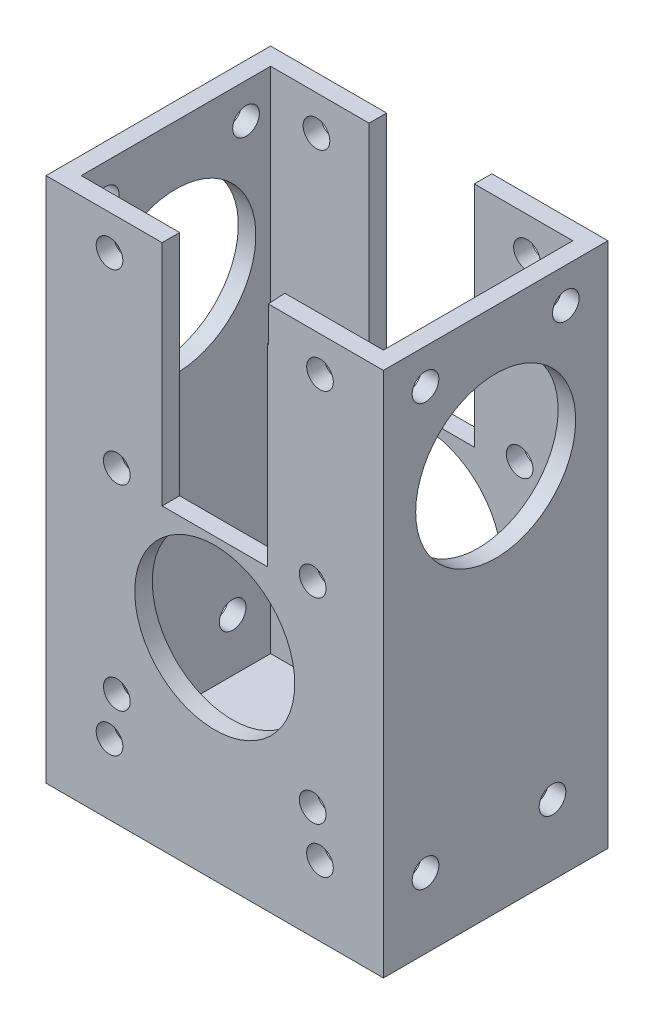
from build123d import *

# Parameters (mm, degrees)
SKETCH1_W           = 61.0616
SKETCH1_H           = 40.64
BOSS_EXTRUDE1_DEPTH = 82.55
SKETCH13_W          = 54.7116
SKETCH13_H          = 34.29
CUT_EXTRUDE1_DEPTH  = 82.55
SKETCH15_R          = 14.478
CUT_EXTRUDE2_DEPTH  = 3.175
CUT_EXTRUDE3_START  = -37.465
SKETCH16_R          = 14.478
CUT_EXTRUDE3_DEPTH  = 3.175
CUT_EXTRUDE4_START  = -61.0616
SKETCH18_R          = 14.478
CUT_EXTRUDE4_DEPTH  = 61.0616
CUT_EXTRUDE5_START  = -40.64
SKETCH19_W          = 19.05
SKETCH19_H          = 34.925
CUT_EXTRUDE5_DEPTH  = 40.64
CUT_EXTRUDE6_START  = -40.64
SKETCH20_R          = 2.413
CUT_EXTRUDE6_DEPTH  = 40.64
CUT_EXTRUDE7_START  = -40.64
SKETCH21_R          = 2.413
CUT_EXTRUDE7_DEPTH  = 40.64
CUT_EXTRUDE8_START  = -40.64
SKETCH24_R          = 2.413
CUT_EXTRUDE8_DEPTH  = 40.64
CUT_EXTRUDE9_START  = -40.64
SKETCH25_R          = 2.413
CUT_EXTRUDE9_DEPTH  = 40.64
BOSS_EXTRUDE2_DEPTH = 6.35
BOSS_EXTRUDE3_DEPTH = 6.35
SKETCH53_W          = 61.0616
SKETCH53_H          = 40.64
SKETCH53_W_2        = 54.7116
SKETCH53_H_2        = 34.29
BOSS_EXTRUDE5_DEPTH = 3.175
SKETCH54_W          = 61.0616
SKETCH54_H          = 40.64
BOSS_EXTRUDE6_DEPTH = 3.175
CUT_EXTRUDE14_START = -40.64
SKETCH45_R          = 2.413
CUT_EXTRUDE14_DEPTH = 40.64
CUT_EXTRUDE18_START = -40.64
SKETCH59_R          = 2.413
CUT_EXTRUDE18_DEPTH = 40.64
CUT_EXTRUDE19_START = -40.64
SKETCH60_R          = 2.413
CUT_EXTRUDE19_DEPTH = 40.64
CUT_EXTRUDE20_START = -40.64
SKETCH61_R          = 2.413
CUT_EXTRUDE20_DEPTH = 40.64
CUT_EXTRUDE21_START = -61.0616
SKETCH63_R          = 2.413
CUT_EXTRUDE21_DEPTH = 61.0616
CUT_EXTRUDE22_START = -61.0616
SKETCH64_R          = 2.413
CUT_EXTRUDE22_DEPTH = 61.0616
CUT_EXTRUDE23_START = -61.0616
SKETCH65_R          = 2.413
CUT_EXTRUDE23_DEPTH = 61.0616
CUT_EXTRUDE24_START = -61.0616
SKETCH66_R          = 2.413
CUT_EXTRUDE24_DEPTH = 61.0616


with BuildPart() as part:
    # Sketch1 → Boss-Extrude1 (new body)
    with BuildSketch(Plane(origin=(0, 0, 0), x_dir=(1, 0, 0), z_dir=(0, 1, 0))):
        with Locations((30.5308, 20.32)):
            Rectangle(SKETCH1_W, SKETCH1_H)
    extrude(amount=BOSS_EXTRUDE1_DEPTH)

    # Sketch13 → Cut-Extrude1 (cut)
    with BuildSketch(Plane(origin=(0, 82.55, 0), x_dir=(1, 0, 0), z_dir=(0, 1, 0))):
        with Locations((30.5308, 20.32)):
            Rectangle(SKETCH13_W, SKETCH13_H)
    extrude(amount=-CUT_EXTRUDE1_DEPTH, mode=Mode.SUBTRACT)

    # Sketch15 → Cut-Extrude2 (cut)
    with BuildSketch(Plane.XY):
        with Locations((30.5308, 31.75)):
            Circle(SKETCH15_R)
    extrude(amount=-CUT_EXTRUDE2_DEPTH, mode=Mode.SUBTRACT)

    # Sketch16 → Cut-Extrude3 (cut)
    with BuildSketch(Plane.XY.offset(CUT_EXTRUDE3_START)):
        with Locations((30.5308, 31.75)):
            Circle(SKETCH16_R)
    extrude(amount=-CUT_EXTRUDE3_DEPTH, mode=Mode.SUBTRACT)

    # Sketch18 → Cut-Extrude4 (cut)
    with BuildSketch(Plane.ZY.offset(CUT_EXTRUDE4_START)):
        with Locations((-20.32, 63.754)):
            Circle(SKETCH18_R)
    extrude(amount=CUT_EXTRUDE4_DEPTH, mode=Mode.SUBTRACT)

    # Sketch19 → Cut-Extrude5 (cut)
    with BuildSketch(Plane(origin=(0, 0, -40.64), x_dir=(-1, 0, 0), z_dir=(0, 0, -1)).offset(CUT_EXTRUDE5_START)):
        with Locations((-30.5308, 65.0875)):
            Rectangle(SKETCH19_W, SKETCH19_H)
    extrude(amount=CUT_EXTRUDE5_DEPTH, mode=Mode.SUBTRACT)

    # Sketch20 → Cut-Extrude6 (cut)
    with BuildSketch(Plane.XY.offset(CUT_EXTRUDE6_START)):
        with Locations((48.26, 14.0208)):
            Circle(SKETCH20_R)
    extrude(amount=CUT_EXTRUDE6_DEPTH, mode=Mode.SUBTRACT)

    # Sketch21 → Cut-Extrude7 (cut)
    with BuildSketch(Plane.XY.offset(CUT_EXTRUDE7_START)):
        with Locations((48.26, 49.473689268)):
            Circle(SKETCH21_R)
    extrude(amount=CUT_EXTRUDE7_DEPTH, mode=Mode.SUBTRACT)

    # Sketch24 → Cut-Extrude8 (cut)
    with BuildSketch(Plane.XY.offset(CUT_EXTRUDE8_START)):
        with Locations((12.807110732, 49.473689268)):
            Circle(SKETCH24_R)
    extrude(amount=CUT_EXTRUDE8_DEPTH, mode=Mode.SUBTRACT)

    # Sketch25 → Cut-Extrude9 (cut)
    with BuildSketch(Plane.XY.offset(CUT_EXTRUDE9_START)):
        with Locations((12.807110732, 14.0208)):
            Circle(SKETCH25_R)
    extrude(amount=CUT_EXTRUDE9_DEPTH, mode=Mode.SUBTRACT)

    # Sketch47 → Boss-Extrude2 (add)
    with BuildSketch(Plane(origin=(0, 82.55, 0), x_dir=(1, 0, 0), z_dir=(0, 1, 0))):
        Polygon((21.0058, 40.64), (21.0058, 37.465), (3.175, 37.465), (3.175, 3.175), (21.0058, 3.175), (21.0058, 0), (0, 0), (0, 40.64), (20.248497821, 40.64), align=None)
    extrude(amount=BOSS_EXTRUDE2_DEPTH)

    # Sketch49 → Boss-Extrude3 (add)
    with BuildSketch(Plane(origin=(0, 82.55, 0), x_dir=(1, 0, 0), z_dir=(0, 1, 0))):
        Polygon((40.0558, 37.465), (40.0558, 40.64), (61.0616, 40.64), (61.0616, 0), (40.224521991, 0), (40.0558, 3.175), (57.8866, 3.175), (57.8866, 37.465), align=None)
    extrude(amount=BOSS_EXTRUDE3_DEPTH)

    # Sketch53 → Boss-Extrude5 (add)
    with BuildSketch(Plane.XZ):
        with Locations((30.5308, -20.32)):
            Rectangle(SKETCH53_W, SKETCH53_H)
        with Locations((30.5308, -20.32)):
            Rectangle(SKETCH53_W_2, SKETCH53_H_2, mode=Mode.SUBTRACT)
    extrude(amount=BOSS_EXTRUDE5_DEPTH)

    # Sketch54 → Boss-Extrude6 (add)
    with BuildSketch(Plane.XZ.offset(3.175)):
        with Locations((30.5308, -20.32)):
            Rectangle(SKETCH54_W, SKETCH54_H)
    extrude(amount=BOSS_EXTRUDE6_DEPTH)

    # Sketch45 → Cut-Extrude14 (cut)
    with BuildSketch(Plane.XY.offset(CUT_EXTRUDE14_START)):
        with Locations((49.5808, 6.35)):
            Circle(SKETCH45_R)
    extrude(amount=CUT_EXTRUDE14_DEPTH, mode=Mode.SUBTRACT)

    # Sketch59 → Cut-Extrude18 (cut)
    with BuildSketch(Plane.XY.offset(CUT_EXTRUDE18_START)):
        with Locations((49.5808, 82.55)):
            Circle(SKETCH59_R)
    extrude(amount=CUT_EXTRUDE18_DEPTH, mode=Mode.SUBTRACT)

    # Sketch60 → Cut-Extrude19 (cut)
    with BuildSketch(Plane.XY.offset(CUT_EXTRUDE19_START)):
        with Locations((11.4808, 6.35)):
            Circle(SKETCH60_R)
    extrude(amount=CUT_EXTRUDE19_DEPTH, mode=Mode.SUBTRACT)

    # Sketch61 → Cut-Extrude20 (cut)
    with BuildSketch(Plane.XY.offset(CUT_EXTRUDE20_START)):
        with Locations((11.4808, 82.55)):
            Circle(SKETCH61_R)
    extrude(amount=CUT_EXTRUDE20_DEPTH, mode=Mode.SUBTRACT)

    # Sketch63 → Cut-Extrude21 (cut)
    with BuildSketch(Plane.ZY.offset(CUT_EXTRUDE21_START)):
        with Locations((-33.02, 82.55)):
            Circle(SKETCH63_R)
    extrude(amount=CUT_EXTRUDE21_DEPTH, mode=Mode.SUBTRACT)

    # Sketch64 → Cut-Extrude22 (cut)
    with BuildSketch(Plane.ZY.offset(CUT_EXTRUDE22_START)):
        with Locations((-7.62, 82.55)):
            Circle(SKETCH64_R)
    extrude(amount=CUT_EXTRUDE22_DEPTH, mode=Mode.SUBTRACT)

    # Sketch65 → Cut-Extrude23 (cut)
    with BuildSketch(Plane.ZY.offset(CUT_EXTRUDE23_START)):
        with Locations((-30.607, 6.35)):
            Circle(SKETCH65_R)
    extrude(amount=CUT_EXTRUDE23_DEPTH, mode=Mode.SUBTRACT)

    # Sketch66 → Cut-Extrude24 (cut)
    with BuildSketch(Plane.ZY.offset(CUT_EXTRUDE24_START)):
        with Locations((-7.62, 6.35)):
            Circle(SKETCH66_R)
    extrude(amount=CUT_EXTRUDE24_DEPTH, mode=Mode.SUBTRACT)


solid = part.part
